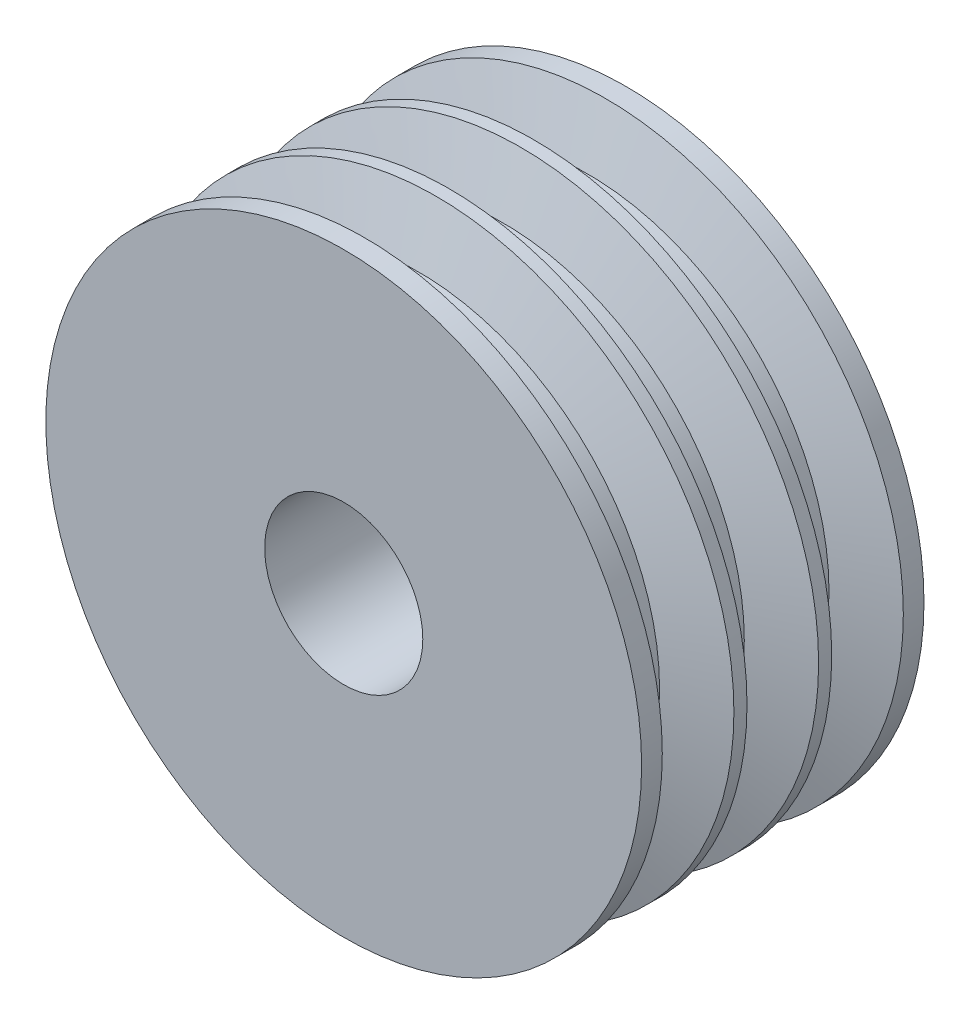
from build123d import *


with BuildPart() as part:
    # 草图2 → 旋转2 (revolve)
    with BuildSketch(Plane(origin=(0, 0, 0), x_dir=(0, 0, -1), z_dir=(1, 0, 0)), mode=Mode.PRIVATE) as revolve_2_sk:
        Polygon((0, 52.75), (3.659240626, 52.75), (6.740704778, 42.670984911), (13.259295222, 42.670984911), (16.340759374, 52.75), (18.659240626, 52.75), (21.740704778, 42.670984911), (28.259295222, 42.670984911), (31.340759374, 52.75), (33.659240626, 52.75), (36.740704778, 42.670984911), (43.259295222, 42.670984911), (46.340759374, 52.75), (50, 52.75), (50, 14), (0, 14), align=None)
    revolve(revolve_2_sk.sketch.rotate(Axis((0, 0, 0), (0, 0, -1)), 90), axis=Axis((0, 0, 0), (0, 0, -1)))


solid = part.part
